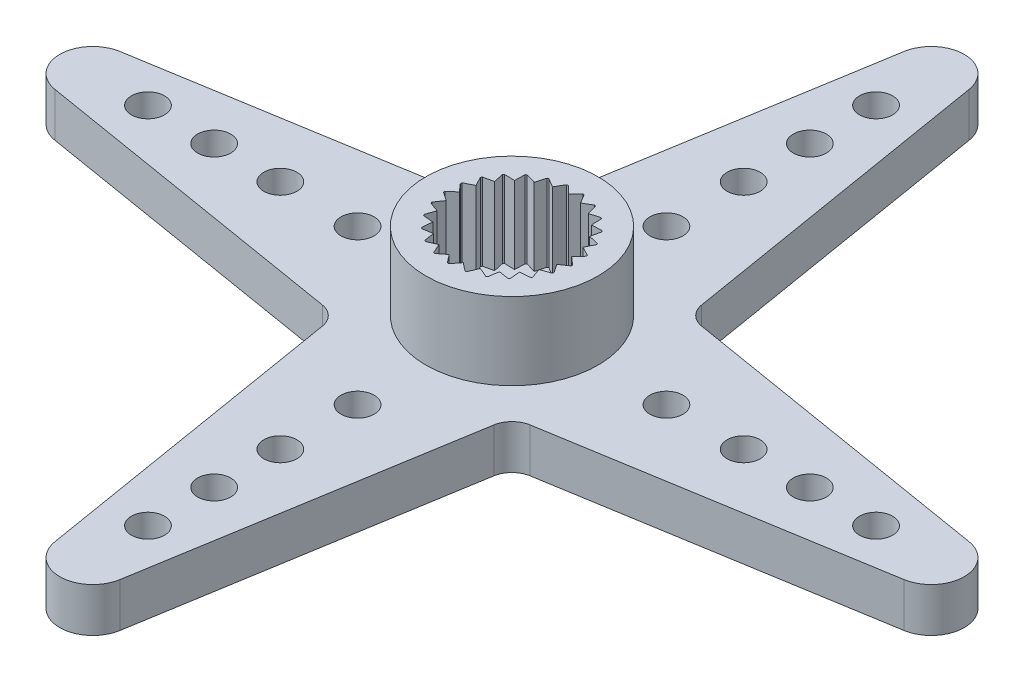
from build123d import *

# Parameters (mm, degrees)
BOSS_EXTRUDE1_DEPTH = 2
SKETCH6_R           = 3.9
BOSS_EXTRUDE3_DEPTH = 3.5
CUT_EXTRUDE3_DEPTH  = 3.5
FILLET2_R           = 1
SKETCH8_R           = 0.75
CUT_EXTRUDE4_DEPTH  = 30.201883501
SKETCH9_R           = 1.5
CUT_EXTRUDE5_DEPTH  = 30.201883501


with BuildPart() as part:
    # Sketch1 → Boss-Extrude1 (new body)
    with BuildSketch(Plane(origin=(0, 0, 0), x_dir=(1, 0, 0), z_dir=(0, 1, 0))):
        with BuildLine():
            Line((-4, 4), (-1.479915293, 19.244644078))
            ThreePointArc((-1.479915293, 19.244644078), (0, 20.5), (1.479915293, 19.244644078))
            Line((1.479915293, 19.244644078), (4, 4))
            Line((4, 4), (19.244644078, 1.479915293))
            ThreePointArc((19.244644078, 1.479915293), (20.5, 0), (19.244644078, -1.479915293))
            Line((19.244644078, -1.479915293), (4, -4))
            Line((4, -4), (1.479915293, -19.244644078))
            ThreePointArc((1.479915293, -19.244644078), (0, -20.5), (-1.479915293, -19.244644078))
            Line((-1.479915293, -19.244644078), (-4, -4))
            Line((-4, -4), (-19.244644078, -1.479915293))
            ThreePointArc((-19.244644078, -1.479915293), (-20.5, 0), (-19.244644078, 1.479915293))
            Line((-19.244644078, 1.479915293), (-4, 4))
        make_face()
    extrude(amount=BOSS_EXTRUDE1_DEPTH)

    # Sketch6 → Boss-Extrude3 (add)
    with BuildSketch(Plane(origin=(0, 2, 0), x_dir=(1, 0, 0), z_dir=(0, 1, 0))):
        with Locations(Location((0, 0, 0), (0, 0, 270))):
            Circle(SKETCH6_R)
    extrude(amount=BOSS_EXTRUDE3_DEPTH)

    # Sketch7 → Cut-Extrude3 (cut)
    with BuildSketch(Plane(origin=(0, 5.5, 0), x_dir=(1, 0, 0), z_dir=(0, 1, 0))):
        with BuildLine():
            Line((0, 2.55), (-0.331043275, 2.881043275))
            ThreePointArc((-0.331043275, 2.881043275), (-0.363466377, 2.877132634), (-0.395843385, 2.872857117))
            Line((-0.395843385, 2.872857117), (-0.634159212, 2.469887061))
            Line((-0.634159212, 2.469887061), (-1.037129268, 2.708202888))
            ThreePointArc((-1.037129268, 2.708202888), (-1.067561203, 2.696351809), (-1.09785775, 2.684158781))
            Line((-1.09785775, 2.684158781), (-1.228471869, 2.234582034))
            Line((-1.228471869, 2.234582034), (-1.678048616, 2.365196153))
            ThreePointArc((-1.678048616, 2.365196153), (-1.704577232, 2.346149284), (-1.730889674, 2.326804877))
            Line((-1.730889674, 2.326804877), (-1.74559512, 1.85887))
            Line((-1.74559512, 1.85887), (-2.213529997, 1.873575446))
            ThreePointArc((-2.213529997, 1.873575446), (-2.234488404, 1.84852957), (-2.255163435, 1.823249265))
            Line((-2.255163435, 1.823249265), (-2.15303621, 1.366358327))
            Line((-2.15303621, 1.366358327), (-2.609927148, 1.264231103))
            ThreePointArc((-2.609927148, 1.264231103), (-2.623998452, 1.234759946), (-2.637736982, 1.205132197))
            Line((-2.637736982, 1.205132197), (-2.425194117, 0.787993336))
            Line((-2.425194117, 0.787993336), (-2.842332978, 0.57545047))
            ThreePointArc((-2.842332978, 0.57545047), (-2.848633027, 0.543405812), (-2.854571815, 0.51129224))
            Line((-2.854571815, 0.51129224), (-2.544968157, 0.160115825))
            Line((-2.544968157, 0.160115825), (-2.896144573, -0.149487832))
            ThreePointArc((-2.896144573, -0.149487832), (-2.894277512, -0.182092507), (-2.892043401, -0.214674088))
            Line((-2.892043401, -0.214674088), (-2.504832489, -0.477822352))
            Line((-2.504832489, -0.477822352), (-2.767980753, -0.865033264))
            ThreePointArc((-2.767980753, -0.865033264), (-2.758063897, -0.896149284), (-2.747797265, -0.927151654))
            Line((-2.747797265, -0.927151654), (-2.307308984, -1.085737193))
            Line((-2.307308984, -1.085737193), (-2.465894523, -1.526225475))
            ThreePointArc((-2.465894523, -1.526225475), (-2.448550984, -1.553897705), (-2.430896921, -1.581372872))
            Line((-2.430896921, -1.581372872), (-1.964808769, -1.625431174))
            Line((-1.964808769, -1.625431174), (-2.008867071, -2.091519326))
            ThreePointArc((-2.008867071, -2.091519326), (-1.985186607, -2.11400902), (-1.961254383, -2.136230616))
            Line((-1.961254383, -2.136230616), (-1.498852393, -2.062993336))
            Line((-1.498852393, -2.062993336), (-1.425615113, -2.525395325))
            ThreePointArc((-1.425615113, -2.525395325), (-1.397085655, -2.541289372), (-1.368379019, -2.556861134))
            Line((-1.368379019, -2.556861134), (-0.938717609, -2.370930039))
            Line((-0.938717609, -2.370930039), (-0.752786514, -2.800591449))
            ThreePointArc((-0.752786514, -2.800591449), (-0.721200673, -2.808891167), (-0.689523369, -2.816834664))
            Line((-0.689523369, -2.816834664), (-0.319599746, -2.529892488))
            Line((-0.319599746, -2.529892488), (-0.03265757, -2.899816112))
            ThreePointArc((-0.03265757, -2.899816112), (0, -2.9), (0.03265757, -2.899816112))
            Line((0.03265757, -2.899816112), (0.319599746, -2.529892488))
            Line((0.319599746, -2.529892488), (0.689523369, -2.816834664))
            ThreePointArc((0.689523369, -2.816834664), (0.721200673, -2.808891167), (0.752786514, -2.800591449))
            Line((0.752786514, -2.800591449), (0.938717609, -2.370930039))
            Line((0.938717609, -2.370930039), (1.368379019, -2.556861134))
            ThreePointArc((1.368379019, -2.556861134), (1.397085655, -2.541289372), (1.425615113, -2.525395325))
            Line((1.425615113, -2.525395325), (1.498852393, -2.062993336))
            Line((1.498852393, -2.062993336), (1.961254383, -2.136230616))
            ThreePointArc((1.961254383, -2.136230616), (1.985186607, -2.11400902), (2.008867071, -2.091519326))
            Line((2.008867071, -2.091519326), (1.964808769, -1.625431174))
            Line((1.964808769, -1.625431174), (2.430896921, -1.581372872))
            ThreePointArc((2.430896921, -1.581372872), (2.448550984, -1.553897705), (2.465894523, -1.526225475))
            Line((2.465894523, -1.526225475), (2.307308984, -1.085737193))
            Line((2.307308984, -1.085737193), (2.747797265, -0.927151654))
            ThreePointArc((2.747797265, -0.927151654), (2.758063897, -0.896149284), (2.767980753, -0.865033264))
            Line((2.767980753, -0.865033264), (2.504832489, -0.477822352))
            Line((2.504832489, -0.477822352), (2.892043401, -0.214674088))
            ThreePointArc((2.892043401, -0.214674088), (2.894277512, -0.182092507), (2.896144573, -0.149487832))
            Line((2.896144573, -0.149487832), (2.544968157, 0.160115825))
            Line((2.544968157, 0.160115825), (2.854571815, 0.51129224))
            ThreePointArc((2.854571815, 0.51129224), (2.848633027, 0.543405812), (2.842332978, 0.57545047))
            Line((2.842332978, 0.57545047), (2.425194117, 0.787993336))
            Line((2.425194117, 0.787993336), (2.637736982, 1.205132197))
            ThreePointArc((2.637736982, 1.205132197), (2.623998452, 1.234759946), (2.609927148, 1.264231103))
            Line((2.609927148, 1.264231103), (2.15303621, 1.366358327))
            Line((2.15303621, 1.366358327), (2.255163435, 1.823249265))
            ThreePointArc((2.255163435, 1.823249265), (2.234488404, 1.84852957), (2.213529997, 1.873575446))
            Line((2.213529997, 1.873575446), (1.74559512, 1.85887))
            Line((1.74559512, 1.85887), (1.730889674, 2.326804877))
            ThreePointArc((1.730889674, 2.326804877), (1.704577232, 2.346149284), (1.678048616, 2.365196153))
            Line((1.678048616, 2.365196153), (1.228471869, 2.234582034))
            Line((1.228471869, 2.234582034), (1.09785775, 2.684158781))
            ThreePointArc((1.09785775, 2.684158781), (1.067561203, 2.696351809), (1.037129268, 2.708202888))
            Line((1.037129268, 2.708202888), (0.634159212, 2.469887061))
            Line((0.634159212, 2.469887061), (0.395843385, 2.872857117))
            ThreePointArc((0.395843385, 2.872857117), (0.363466377, 2.877132634), (0.331043275, 2.881043275))
            Line((0.331043275, 2.881043275), (0, 2.55))
        make_face()
    extrude(amount=-CUT_EXTRUDE3_DEPTH, mode=Mode.SUBTRACT)

    # Fillet2
    fillet2_edges = [part.edges().sort_by_distance(p)[0] for p in [
        (-4, 1, -4),
        (4, 1, -4),
        (4, 1, 4),
        (-4, 1, 4),
    ]]
    fillet(fillet2_edges, radius=FILLET2_R)

    # Sketch8 → Cut-Extrude4 (cut, through all)
    with BuildSketch(Plane(origin=(0, 2, 0), x_dir=(1, 0, 0), z_dir=(0, 1, 0))):
        with Locations(Location((0, 16.5, 0), (0, 0, 270))):
            Circle(SKETCH8_R)
        with Locations(Location((0, 13.5, 0), (0, 0, 270))):
            Circle(SKETCH8_R)
        with Locations(Location((0, 10.5, 0), (0, 0, 270))):
            Circle(SKETCH8_R)
        with Locations(Location((0, 7, 0), (0, 0, 270))):
            Circle(SKETCH8_R)
        with Locations(Location((16.5, 0, 0), (0, 0, 270))):
            Circle(SKETCH8_R)
        with Locations(Location((13.5, 0, 0), (0, 0, 270))):
            Circle(SKETCH8_R)
        with Locations(Location((10.5, 0, 0), (0, 0, 270))):
            Circle(SKETCH8_R)
        with Locations(Location((7, 0, 0), (0, 0, 270))):
            Circle(SKETCH8_R)
        with Locations(Location((0, -16.5, 0), (0, 0, 270))):
            Circle(SKETCH8_R)
        with Locations(Location((0, -13.5, 0), (0, 0, 270))):
            Circle(SKETCH8_R)
        with Locations(Location((0, -10.5, 0), (0, 0, 270))):
            Circle(SKETCH8_R)
        with Locations(Location((0, -7, 0), (0, 0, 270))):
            Circle(SKETCH8_R)
        with Locations(Location((-16.5, 0, 0), (0, 0, 270))):
            Circle(SKETCH8_R)
        with Locations(Location((-13.5, 0, 0), (0, 0, 270))):
            Circle(SKETCH8_R)
        with Locations(Location((-10.5, 0, 0), (0, 0, 270))):
            Circle(SKETCH8_R)
        with Locations(Location((-7, 0, 0), (0, 0, 270))):
            Circle(SKETCH8_R)
    extrude(amount=-CUT_EXTRUDE4_DEPTH, mode=Mode.SUBTRACT)

    # Sketch9 → Cut-Extrude5 (cut, through all)
    with BuildSketch(Plane(origin=(0, 2, 0), x_dir=(1, 0, 0), z_dir=(0, 1, 0))):
        with Locations(Location((0, 0, 0), (0, 0, 270))):
            Circle(SKETCH9_R)
    extrude(amount=-CUT_EXTRUDE5_DEPTH, mode=Mode.SUBTRACT)


solid = part.part
